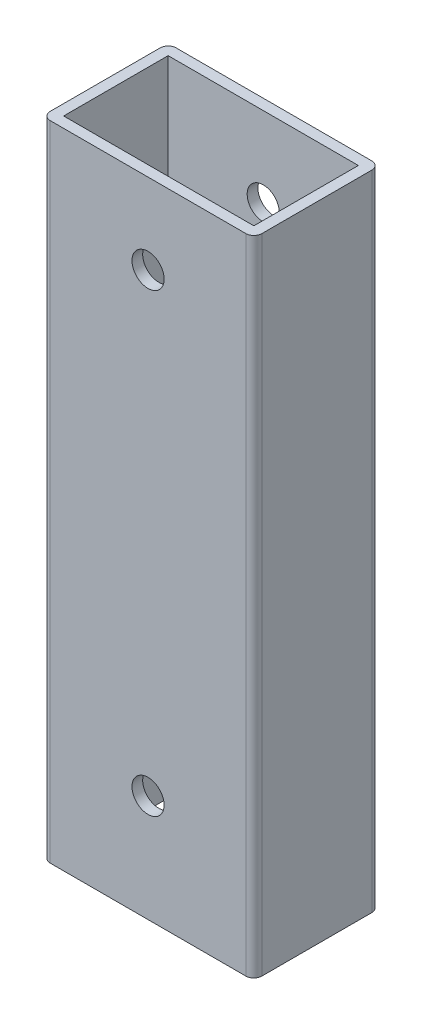
from build123d import *

# Parameters (mm, degrees)
SKETCH1_W               = 39.5
SKETCH1_H               = 23.5
SKETCH1_W_2             = 35.5
SKETCH1_H_2             = 19.5
BOSS_EXTRUDE1_DEPTH     = 120
CUT_EXTRUDE1_DEPTH      = 124.500253036
CUT_EXTRUDE1_DEPTH_BACK = 124.500253036
SKETCH2_R               = 3
FILLET1_R               = 1.5


with BuildPart() as part:
    # Sketch1 → Boss-Extrude1 (new body)
    with BuildSketch(Plane(origin=(0, 0, 0), x_dir=(1, 0, 0), z_dir=(0, 1, 0))):
        Rectangle(SKETCH1_W, SKETCH1_H)
        Rectangle(SKETCH1_W_2, SKETCH1_H_2, mode=Mode.SUBTRACT)
    extrude(amount=BOSS_EXTRUDE1_DEPTH)

    # Sketch2 → Cut-Extrude1 (cut, two sides: drawn at the far end of the back side and taken through both)
    with BuildSketch(Plane(origin=(0, 0, 9.75), x_dir=(-1, 0, 0), z_dir=(0, 0, -1)).offset(-CUT_EXTRUDE1_DEPTH_BACK)):
        with Locations((0, 105)):
            Circle(SKETCH2_R)
        with Locations((0, 20)):
            Circle(SKETCH2_R)
    extrude(amount=CUT_EXTRUDE1_DEPTH + CUT_EXTRUDE1_DEPTH_BACK, mode=Mode.SUBTRACT)

    # Fillet1
    fillet1_edges = [part.edges().sort_by_distance(p)[0] for p in [
        (19.75, 60, 11.75),
        (-19.75, 60, 11.75),
        (-19.75, 60, -11.75),
        (19.75, 60, -11.75),
    ]]
    fillet(fillet1_edges, radius=FILLET1_R)


solid = part.part
